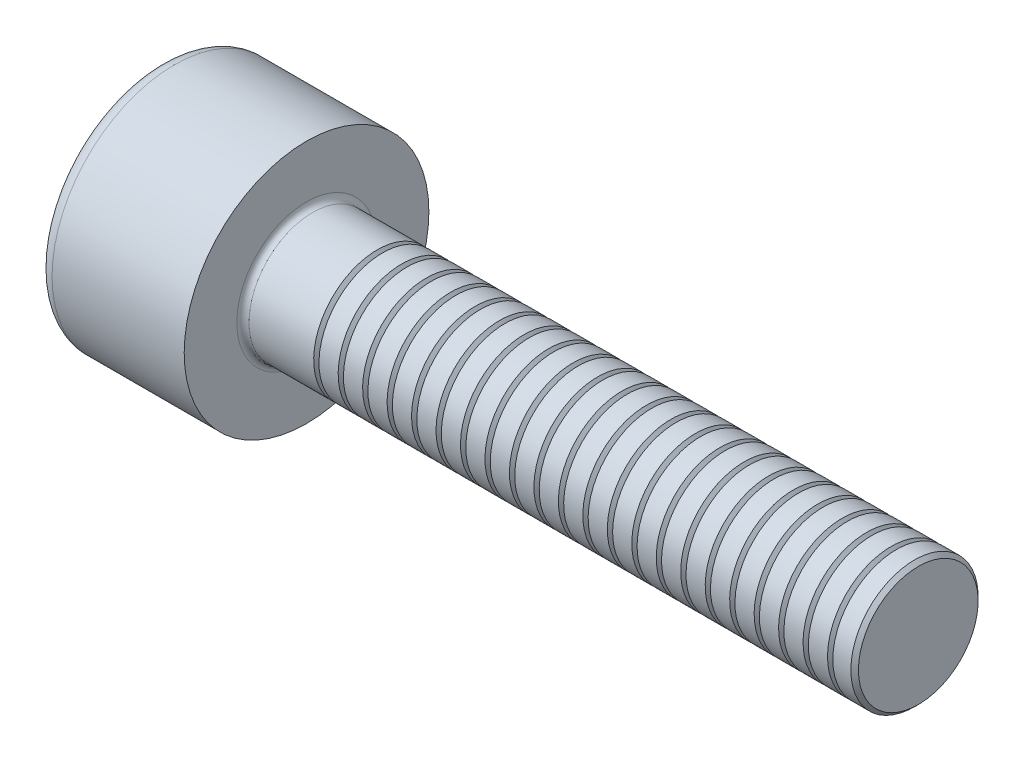
from build123d import *

# Parameters (mm, degrees)
FILLET1_R       = 0.25
FILLET2_R       = 0.6
HEX_2_DEPTH     = 3
THDSCHPAT_COUNT = 22
THDSCHPAT_PITCH = 1


with BuildPart() as part:
    # BodySke → Base-Revolve (revolve)
    with BuildSketch(Plane.XY, mode=Mode.PRIVATE) as base_revolve_sk:
        Polygon((0, 0), (0, 5), (6, 5), (6, 2.6), (30.8455, 2.6), (31, 2.4455), (31, 0), align=None)
    revolve(base_revolve_sk.sketch.rotate(Axis((-31.75, 0, 0), (1, 0, 0)), 90), axis=Axis((-31.75, 0, 0), (1, 0, 0)))

    # Fillet1
    fillet1_edges = [part.edges().sort_by_distance(p)[0] for p in [
        (6, 0, -2.6),
    ]]
    fillet(fillet1_edges, radius=FILLET1_R)

    # Fillet2
    fillet2_edges = [part.edges().sort_by_distance(p)[0] for p in [
        (0, 0, -5),
    ]]
    fillet(fillet2_edges, radius=FILLET2_R)

    # Sketch2 → Hex-PreBroach (revolve, cut)
    with BuildSketch(Plane.XY, mode=Mode.PRIVATE) as hex_prebroach_sk:
        Polygon((0, 2.51), (3, 2.51), (4.449149176, 0), (0, 0), align=None)
    revolve(hex_prebroach_sk.sketch.rotate(Axis((0, 0, 0), (1, 0, 0)), 90), axis=Axis((0, 0, 0), (1, 0, 0)), mode=Mode.SUBTRACT)

    # Sketch3 → Hex 2 (cut)
    with BuildSketch(Plane(origin=(0, 0, 0), x_dir=(0, 0.500000000000001, 0.866025403784438), z_dir=(-1, 0, 0))):
        Polygon((1.449149176, 2.51), (-1.449149176, 2.51), (-2.898298351, 0), (-1.449149176, -2.51), (1.449149176, -2.51), (2.898298351, 0), align=None)
    extrude(amount=-HEX_2_DEPTH, mode=Mode.SUBTRACT)

    # ThdSchSke → ThreadSchematic (revolve, cut)
    with BuildSketch(Plane.XY):
        Polygon((9, -2.4455), (8.891817935, -2.6), (8.891817935, -3.25), (9.108182065, -3.25), (9.108182065, -2.6), align=None)
    threadschematic = revolve(axis=Axis((-3.175, 0, 0), (1, 0, 0)), mode=Mode.SUBTRACT)

    # ThdSchPat: ThreadSchematic ×22
    with Locations(*[(i * THDSCHPAT_PITCH, 0, 0) for i in range(1, THDSCHPAT_COUNT)]):
        add(threadschematic, mode=Mode.SUBTRACT)


solid = part.part
